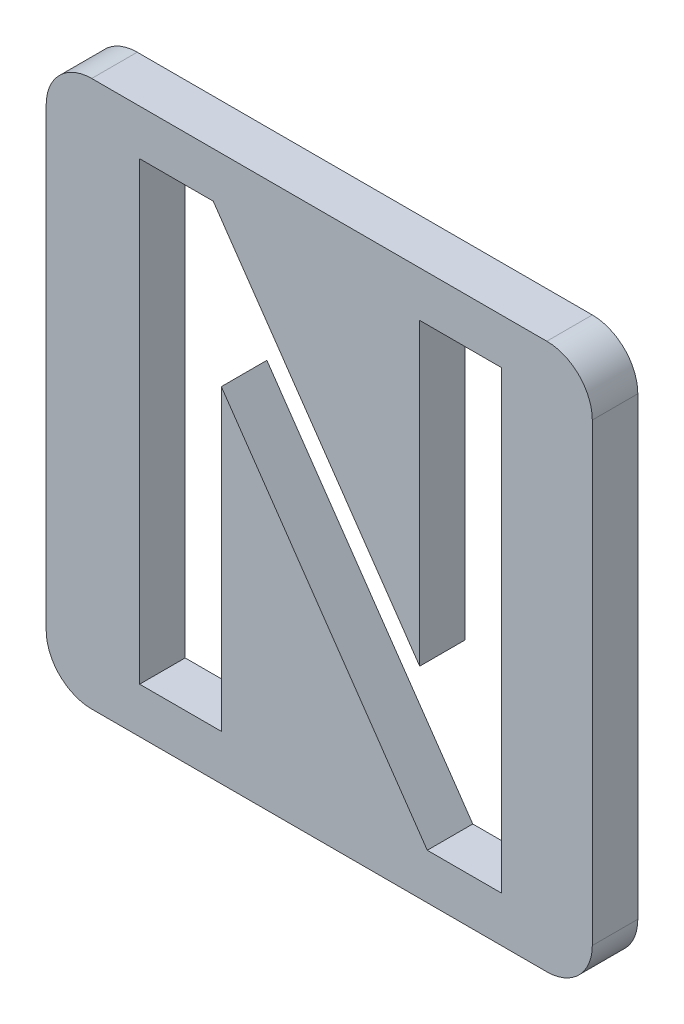
from build123d import *

# Parameters (mm, degrees)
BOSS_EXTRUDE1_DEPTH = 10
CUT_EXTRUDE27_DEPTH = 10


with BuildPart() as part:
    # Sketch1 → Boss-Extrude1 (new body)
    with BuildSketch(Plane.XY):
        with BuildLine():
            Line((-50, 60), (50, 60))
            ThreePointArc((50, 60), (57.071067812, 57.071067812), (60, 50))
            Line((60, 50), (60, -50))
            ThreePointArc((60, -50), (57.071067812, -57.071067812), (50, -60))
            Line((50, -60), (-50, -60))
            ThreePointArc((-50, -60), (-57.071067812, -57.071067812), (-60, -50))
            Line((-60, -50), (-60, 50))
            ThreePointArc((-60, 50), (-57.071067812, 57.071067812), (-50, 60))
        make_face()
    extrude(amount=BOSS_EXTRUDE1_DEPTH)

    # Sketch2 → Cut-Extrude27 (cut)
    with BuildSketch(Plane.XY.offset(10)):
        Polygon((-39.461538462, 50), (-23.295673077, 50), (22.076923077, -15.805288462), (22.076923077, 50), (40.025641026, 50), (40.025641026, -50), (23.739583333, -50), (-21.512820513, 15.604967949), (-21.512820513, -50), (-39.461538462, -50), align=None)
    extrude(amount=-CUT_EXTRUDE27_DEPTH, mode=Mode.SUBTRACT)


solid = part.part
